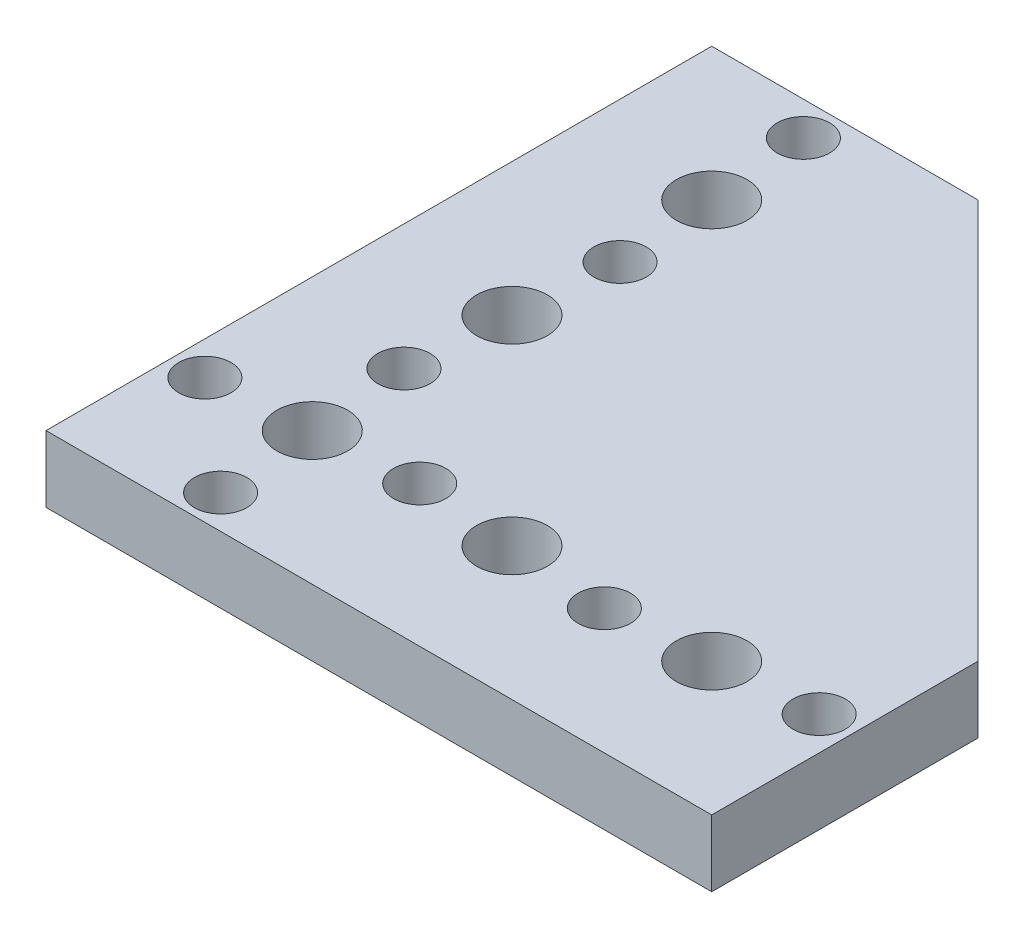
from build123d import *

# Parameters (mm, degrees)
SKETCH1_R           = 2.5
SKETCH1_R_2         = 3.375
BOSS_EXTRUDE1_DEPTH = 6.35


with BuildPart() as part:
    # Sketch1 → Boss-Extrude1 (new body)
    with BuildSketch(Plane(origin=(0, 6.35, 0), x_dir=(1, 0, 0), z_dir=(0, 1, 0))):
        Polygon((25.4, 63.5), (0, 63.5), (0, 0), (63.5, 0), (63.5, 25.4), align=None)
        with Locations(Location((13.4512, 41.304668328, 0), (0, 0, 90))):
            Circle(SKETCH1_R, mode=Mode.SUBTRACT)
        with Locations(Location((11.9488, 60.295331672, 0), (0, 0, 90))):
            Circle(SKETCH1_R, mode=Mode.SUBTRACT)
        with Locations(Location((11.9488, 22.195331672, 0), (0, 0, 90))):
            Circle(SKETCH1_R, mode=Mode.SUBTRACT)
        with Locations(Location((13.4512, 3.204668328, 0), (0, 0, 90))):
            Circle(SKETCH1_R, mode=Mode.SUBTRACT)
        with Locations(Location((22.195331672, 13.4512, 0), (0, 0, 90))):
            Circle(SKETCH1_R, mode=Mode.SUBTRACT)
        with Locations(Location((3.204668328, 11.9488, 0), (0, 0, 90))):
            Circle(SKETCH1_R, mode=Mode.SUBTRACT)
        with Locations(Location((41.304668328, 11.9488, 0), (0, 0, 90))):
            Circle(SKETCH1_R, mode=Mode.SUBTRACT)
        with Locations(Location((60.295331672, 13.4512, 0), (0, 0, 90))):
            Circle(SKETCH1_R, mode=Mode.SUBTRACT)
        with Locations(Location((12.7, 50.8, 0), (0, 0, 90))):
            Circle(SKETCH1_R_2, mode=Mode.SUBTRACT)
        with Locations(Location((12.7, 31.75, 0), (0, 0, 90))):
            Circle(SKETCH1_R_2, mode=Mode.SUBTRACT)
        with Locations(Location((50.8, 12.7, 0), (0, 0, 90))):
            Circle(SKETCH1_R_2, mode=Mode.SUBTRACT)
        with Locations(Location((31.75, 12.7, 0), (0, 0, 90))):
            Circle(SKETCH1_R_2, mode=Mode.SUBTRACT)
        with Locations(Location((12.7, 12.7, 0), (0, 0, 90))):
            Circle(SKETCH1_R_2, mode=Mode.SUBTRACT)
    extrude(amount=-BOSS_EXTRUDE1_DEPTH)


solid = part.part
